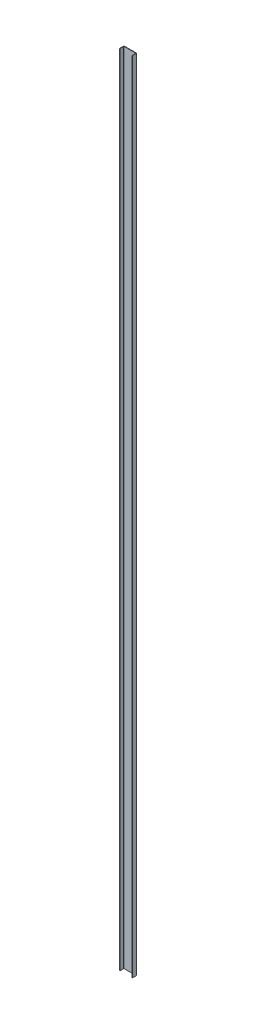
from build123d import *

# Parameters (mm, degrees)
BOSS_EXTRUDE1_DEPTH = 2000
FILLET1_R           = 1


with BuildPart() as part:
    # Sketch1 → Boss-Extrude1 (new body)
    with BuildSketch(Plane(origin=(0, 0, 0), x_dir=(1, 0, 0), z_dir=(0, 1, 0))):
        Polygon((0, 0), (0, 10), (30, 10), (30, 0), (31, 0), (31, 11), (-1, 11), (-1, 0), align=None)
    extrude(amount=BOSS_EXTRUDE1_DEPTH)

    # Fillet1
    fillet1_edges = [part.edges().sort_by_distance(p)[0] for p in [
        (-1, 1000, -11),
        (31, 1000, -11),
        (30, 1000, -10),
        (0, 1000, -10),
    ]]
    fillet(fillet1_edges, radius=FILLET1_R)


solid = part.part
